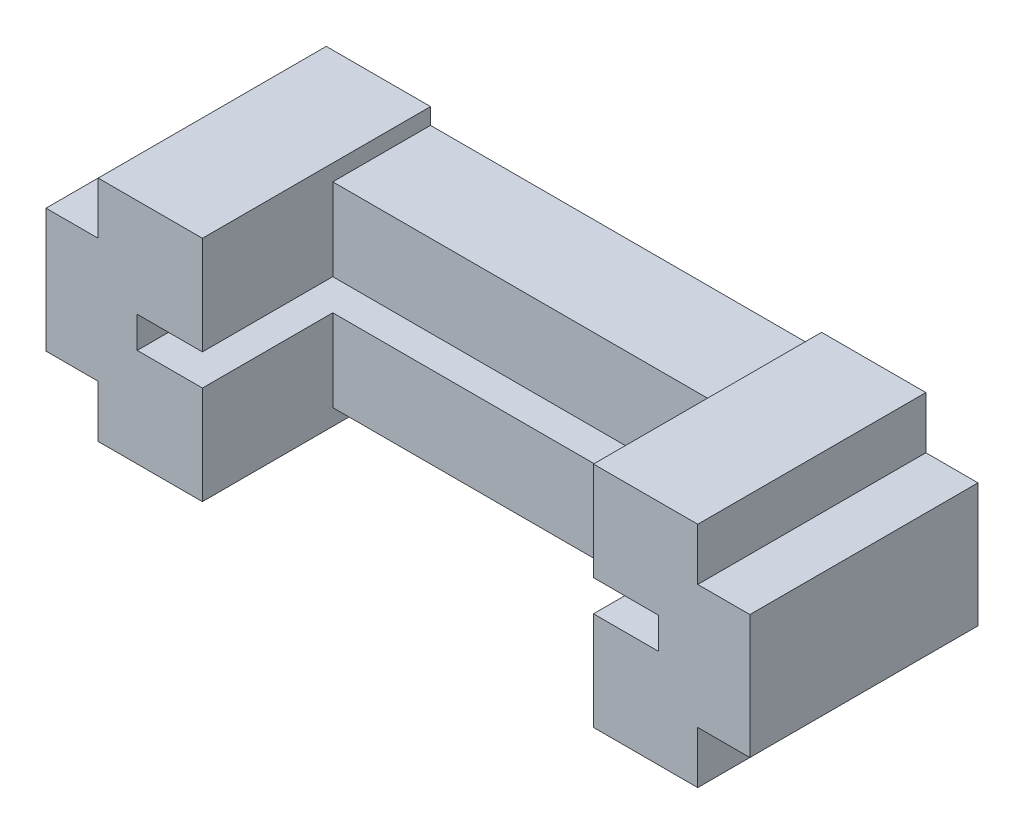
from build123d import *

# Parameters (mm, degrees)
BOSS_EXTRUDE1_DEPTH     = 9.525
BOSS_EXTRUDE2_DEPTH     = 12.7
SKETCH4_W               = 50.8
SKETCH4_H               = 3.048
CUT_EXTRUDE1_DEPTH      = 6.096
CUT_EXTRUDE2_DEPTH      = 39.217558219
CUT_EXTRUDE2_DEPTH_BACK = 39.217558219
SKETCH5_W               = 38.1
SKETCH5_H               = 1.5875


with BuildPart() as part:
    # Sketch1 → Boss-Extrude1 (new body)
    with BuildSketch(Plane.XY):
        Polygon((-29.21, -11.1125), (29.21, -11.1125), (29.21, -6.0325), (34.29, -6.0325), (34.29, 6.0325), (29.21, 6.0325), (29.21, 11.1125), (-29.21, 11.1125), (-29.21, 6.0325), (-34.29, 6.0325), (-34.29, -6.0325), (-29.21, -6.0325), align=None)
    extrude(amount=BOSS_EXTRUDE1_DEPTH)

    # Sketch3 → Boss-Extrude2 (add)
    with BuildSketch(Plane.XY.offset(9.525)):
        Polygon((-29.21, 11.1125), (-19.05, 11.1125), (-19.05, 1.524), (-25.4, 1.524), (-25.4, -1.524), (-19.05, -1.524), (-19.05, -11.1125), (-29.21, -11.1125), (-29.21, -6.0325), (-34.29, -6.0325), (-34.29, 6.0325), (-29.21, 6.0325), align=None)
        Polygon((19.05, -1.524), (19.05, -11.1125), (29.21, -11.1125), (29.21, -6.0325), (34.29, -6.0325), (34.29, 6.0325), (29.21, 6.0325), (29.21, 11.1125), (19.05, 11.1125), (19.05, 1.524), (25.4, 1.524), (25.4, -1.524), align=None)
    extrude(amount=BOSS_EXTRUDE2_DEPTH)

    # Sketch4 → Cut-Extrude1 (cut)
    with BuildSketch(Plane.XY.offset(9.525)):
        Rectangle(SKETCH4_W, SKETCH4_H)
    extrude(amount=-CUT_EXTRUDE1_DEPTH, mode=Mode.SUBTRACT)

    # Sketch5 → Cut-Extrude2 (cut, two sides: drawn at the far end of the back side and taken through both)
    with BuildSketch(Plane.XY.offset(9.525).offset(-CUT_EXTRUDE2_DEPTH_BACK)):
        with Locations((0, 10.31875)):
            Rectangle(SKETCH5_W, SKETCH5_H)
        with Locations((0, -10.31875)):
            Rectangle(SKETCH5_W, SKETCH5_H)
    extrude(amount=CUT_EXTRUDE2_DEPTH + CUT_EXTRUDE2_DEPTH_BACK, mode=Mode.SUBTRACT)


solid = part.part
